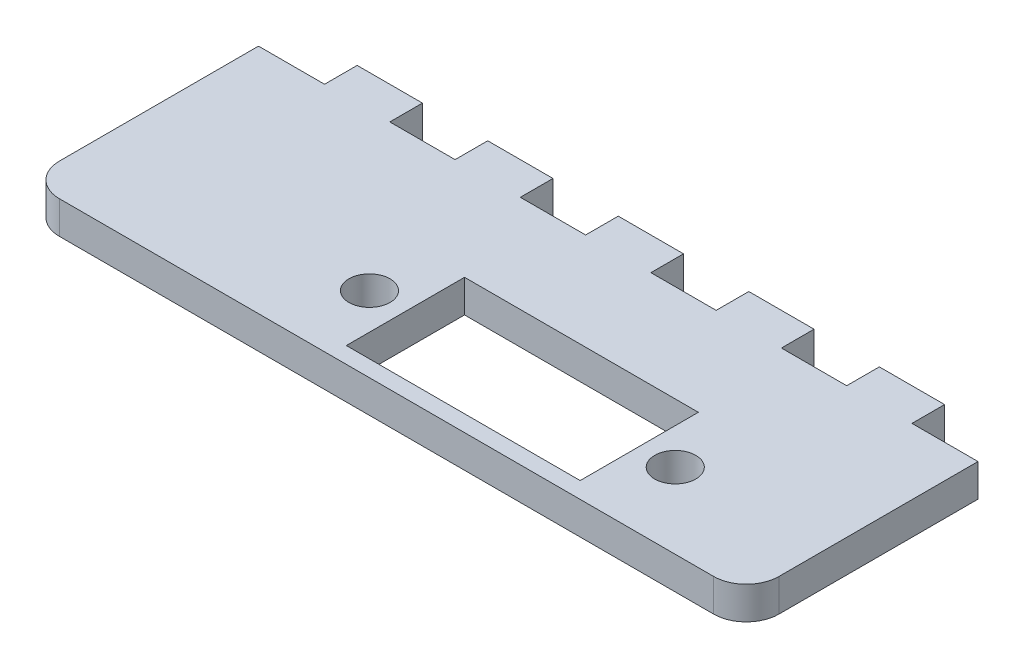
from build123d import *

# Parameters (mm, degrees)
SKETCH1_R           = 2
SKETCH1_W           = 22.75
SKETCH1_H           = 11.5
BOSS_EXTRUDE1_DEPTH = 3.175
FILLET1_R           = 3.175


with BuildPart() as part:
    # Sketch1 → Boss-Extrude1 (new body)
    with BuildSketch(Plane(origin=(0, 0, 0), x_dir=(1, 0, 0), z_dir=(0, 1, 0))):
        Polygon((0, 0), (70, 0), (70, 22.5425), (63.575, 22.5425), (63.575, 25.7175), (57.225, 25.7175), (57.225, 22.5425), (50.875, 22.5425), (50.875, 25.7175), (44.525, 25.7175), (44.525, 22.5425), (38.175, 22.5425), (38.175, 25.7175), (31.825, 25.7175), (31.825, 22.5425), (25.475, 22.5425), (25.475, 25.7175), (19.125, 25.7175), (19.125, 22.5425), (12.775, 22.5425), (12.775, 25.7175), (6.425, 25.7175), (6.425, 22.5425), (0, 22.5425), align=None)
        with Locations(Location((26, 7.3375, 0), (0, 0, 270))):
            Circle(SKETCH1_R, mode=Mode.SUBTRACT)
        with Locations(Location((55.75, 7.3375, 0), (0, 0, 90))):
            Circle(SKETCH1_R, mode=Mode.SUBTRACT)
        with Locations((40.875, 7.3375)):
            Rectangle(SKETCH1_W, SKETCH1_H, mode=Mode.SUBTRACT)
    extrude(amount=BOSS_EXTRUDE1_DEPTH)

    # Fillet1
    fillet1_edges = [part.edges().sort_by_distance(p)[0] for p in [
        (70, 1.5875, 0),
        (0, 1.5875, 0),
    ]]
    fillet(fillet1_edges, radius=FILLET1_R)


solid = part.part
